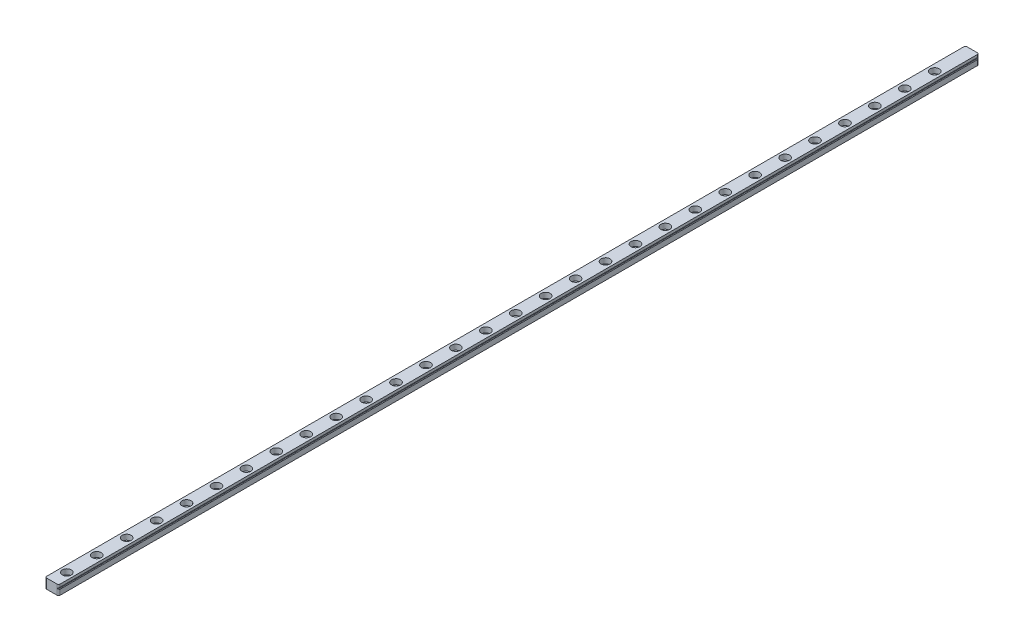
from build123d import *

# Parameters (mm, degrees)
EXTRUDE_2_DEPTH        = 615
SKETCH_3_R             = 3
CUT_EXTRUDE_1_DEPTH    = 3.5
SKETCH_4_R             = 1.75
CUT_EXTRUDE_2_DEPTH    = 3
PATTERN_LINEAR_1_COUNT = 30
PATTERN_LINEAR_1_PITCH = 20
FILLET_1_R             = 1


with BuildPart() as part:
    # 草图2 → 凸台-拉伸2 (new body)
    with BuildSketch(Plane.XY):
        Polygon((0, 0), (9, 0), (9, 3.5), (8.646446609, 3.853553391), (8.146446609, 3.853553391), (8.146446609, 4.353553391), (8.646446609, 4.353553391), (9, 4.707106781), (9, 6.5), (0, 6.5), (0, 4.707106781), (0.353553391, 4.353553391), (0.853553391, 4.353553391), (0.853553391, 3.853553391), (0.353553391, 3.853553391), (0, 3.5), align=None)
    extrude(amount=-EXTRUDE_2_DEPTH)

    # 草图3 → 切除-拉伸1 (cut)
    with BuildSketch(Plane(origin=(0, 6.5, 0), x_dir=(1, 0, 0), z_dir=(0, 1, 0))):
        with Locations(Location((4.5, 10, 0), (0, 0, 270))):
            Circle(SKETCH_3_R)
    cut_extrude_1 = extrude(amount=-CUT_EXTRUDE_1_DEPTH, mode=Mode.SUBTRACT)

    # 草图4 → 切除-拉伸2 (cut)
    with BuildSketch(Plane(origin=(0, 3, 0), x_dir=(1, 0, 0), z_dir=(0, 1, 0))):
        with Locations(Location((4.5, 10, 0), (0, 0, 270))):
            Circle(SKETCH_4_R)
    cut_extrude_2 = extrude(amount=-CUT_EXTRUDE_2_DEPTH, mode=Mode.SUBTRACT)

    # 阵列(线性)1: 切除-拉伸1, 切除-拉伸2 ×30
    with Locations(*[(0, 0, -i * PATTERN_LINEAR_1_PITCH) for i in range(1, PATTERN_LINEAR_1_COUNT)]):
        add(cut_extrude_1, mode=Mode.SUBTRACT)
        add(cut_extrude_2, mode=Mode.SUBTRACT)

    # 圆角1
    fillet_1_edges = [part.edges().sort_by_distance(p)[0] for p in [
        (9, 1.75, -615),
        (0, 1.75, -615),
        (9, 1.75, 0),
        (0, 1.75, 0),
    ]]
    fillet(fillet_1_edges, radius=FILLET_1_R)


solid = part.part
